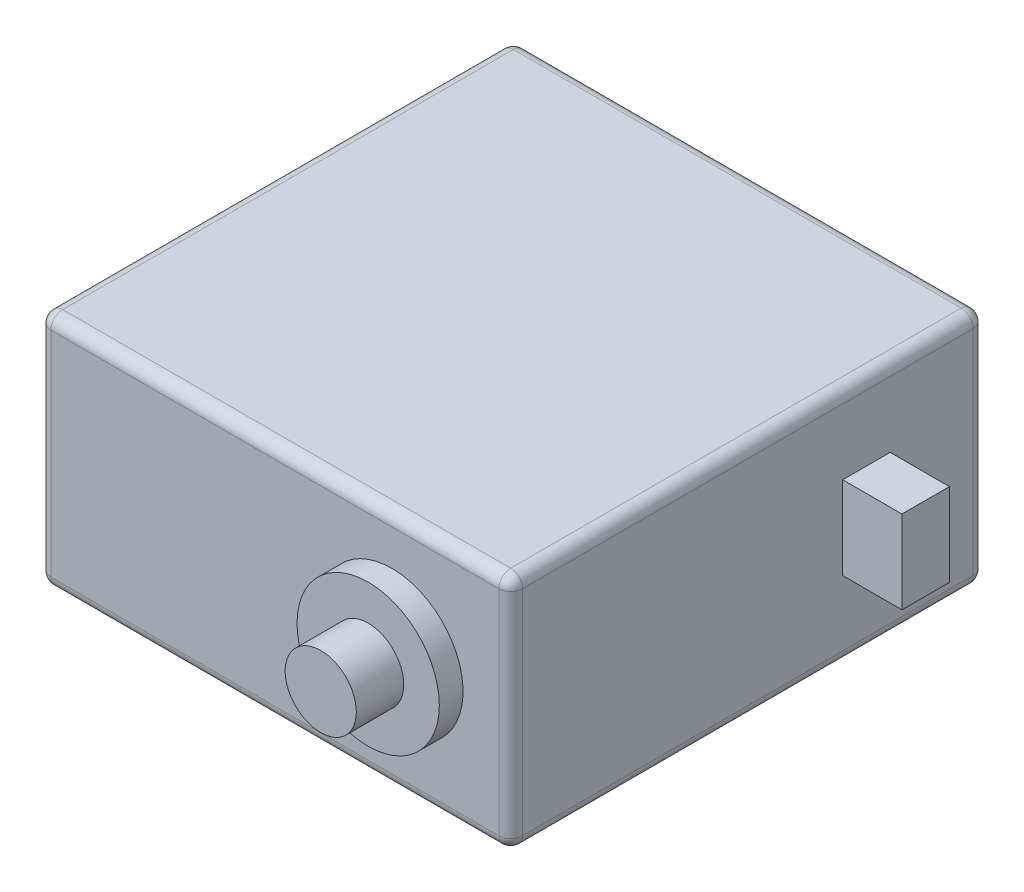
from build123d import *

# Parameters (mm, degrees)
SKETCH1_W           = 39.78
SKETCH1_H           = 40
BOSS_EXTRUDE1_DEPTH = 20.04
SKETCH2_R           = 6
BOSS_EXTRUDE2_DEPTH = 2
SKETCH3_R           = 3
BOSS_EXTRUDE3_DEPTH = 4
FILLET2_R           = 1
SKETCH5_W           = 4
SKETCH5_H           = 7
BOSS_EXTRUDE5_DEPTH = 5


with BuildPart() as part:
    # Sketch1 → Boss-Extrude1 (new body)
    with BuildSketch(Plane(origin=(0, 0, 0), x_dir=(1, 0, 0), z_dir=(0, 1, 0))):
        Rectangle(SKETCH1_W, SKETCH1_H)
    extrude(amount=BOSS_EXTRUDE1_DEPTH)

    # Sketch2 → Boss-Extrude2 (add)
    with BuildSketch(Plane.XY.offset(20)):
        with Locations(Location((9.87, 10.02, 0), (0, 0, 180))):
            Circle(SKETCH2_R)
    boss_extrude2 = extrude(amount=BOSS_EXTRUDE2_DEPTH)

    # Sketch3 → Boss-Extrude3 (add)
    with BuildSketch(Plane.XY.offset(22)):
        with Locations((9.87, 10.02)):
            Circle(SKETCH3_R)
    boss_extrude3 = extrude(amount=BOSS_EXTRUDE3_DEPTH)

    # Fillet2
    fillet2_edges = [part.edges().sort_by_distance(p)[0] for p in [
        (19.89, 20.04, 0),
        (0, 20.04, -20),
        (-19.89, 20.04, 0),
        (0, 0, -20),
        (19.89, 0, 0),
        (0, 0, 20),
        (-19.89, 0, 0),
        (-19.89, 10.02, -20),
        (19.89, 10.02, -20),
        (19.89, 10.02, 20),
        (-19.89, 10.02, 20),
        (0, 20.04, 20),
    ]]
    fillet(fillet2_edges, radius=FILLET2_R)

    # Sketch5 → Boss-Extrude5 (add)
    with BuildSketch(Plane(origin=(19.89, 0, 0), x_dir=(0, 0, -1), z_dir=(1, 0, 0))):
        with Locations((10, 10)):
            Rectangle(SKETCH5_W, SKETCH5_H)
    extrude(amount=BOSS_EXTRUDE5_DEPTH)

    # Mirror1: Boss-Extrude2, Boss-Extrude3 across plane
    add(boss_extrude2.mirror(Plane.XY))
    add(boss_extrude3.mirror(Plane.XY))


solid = part.part
